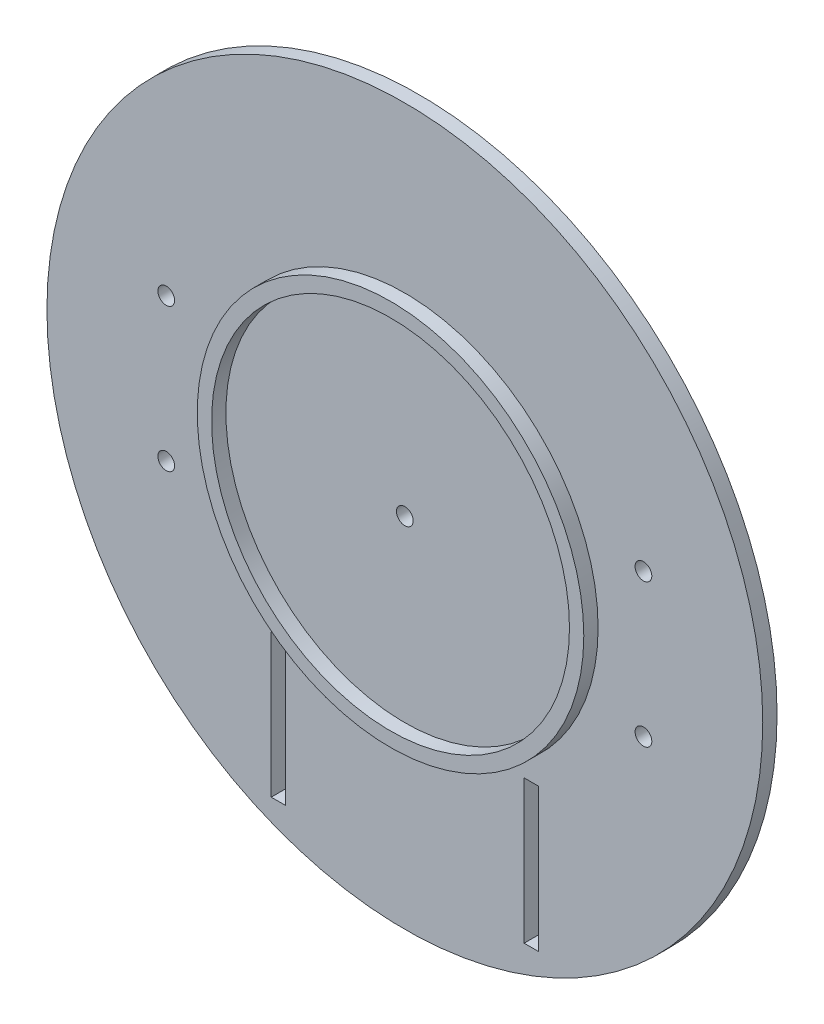
from build123d import *

# Parameters (mm, degrees)
SKETCH1_R           = 75
BOSS_EXTRUDE1_DEPTH = 3
SKETCH2_R           = 1.75
CUT_EXTRUDE1_DEPTH  = 107.108435103
SKETCH3_R           = 40.5
SKETCH3_R_2         = 37.5
BOSS_EXTRUDE2_DEPTH = 3
SKETCH4_W           = 3
SKETCH4_H           = 30
CUT_EXTRUDE2_DEPTH  = 107.235587258


with BuildPart() as part:
    # Sketch1 → Boss-Extrude1 (new body)
    with BuildSketch(Plane.XY):
        Circle(SKETCH1_R)
    extrude(amount=BOSS_EXTRUDE1_DEPTH)

    # Sketch2 → Cut-Extrude1 (cut, through all)
    with BuildSketch(Plane.XY.offset(3)):
        with Locations((-50, 15)):
            Circle(SKETCH2_R)
        with Locations((-50, -15)):
            Circle(SKETCH2_R)
        with Locations((50, -15)):
            Circle(SKETCH2_R)
        with Locations((50, 15)):
            Circle(SKETCH2_R)
        Circle(SKETCH2_R)
    extrude(amount=-CUT_EXTRUDE1_DEPTH, mode=Mode.SUBTRACT)

    # Sketch3 → Boss-Extrude2 (add)
    with BuildSketch(Plane.XY.offset(3)):
        Circle(SKETCH3_R)
        Circle(SKETCH3_R_2, mode=Mode.SUBTRACT)
    extrude(amount=BOSS_EXTRUDE2_DEPTH)

    # Sketch4 → Cut-Extrude2 (cut, through all)
    with BuildSketch(Plane(origin=(0, 0, 0), x_dir=(-1, 0, 0), z_dir=(0, 0, -1))):
        with Locations((-26.5, -50)):
            Rectangle(SKETCH4_W, SKETCH4_H)
        with Locations((26.5, -50)):
            Rectangle(SKETCH4_W, SKETCH4_H)
    extrude(amount=-CUT_EXTRUDE2_DEPTH, mode=Mode.SUBTRACT)


solid = part.part
